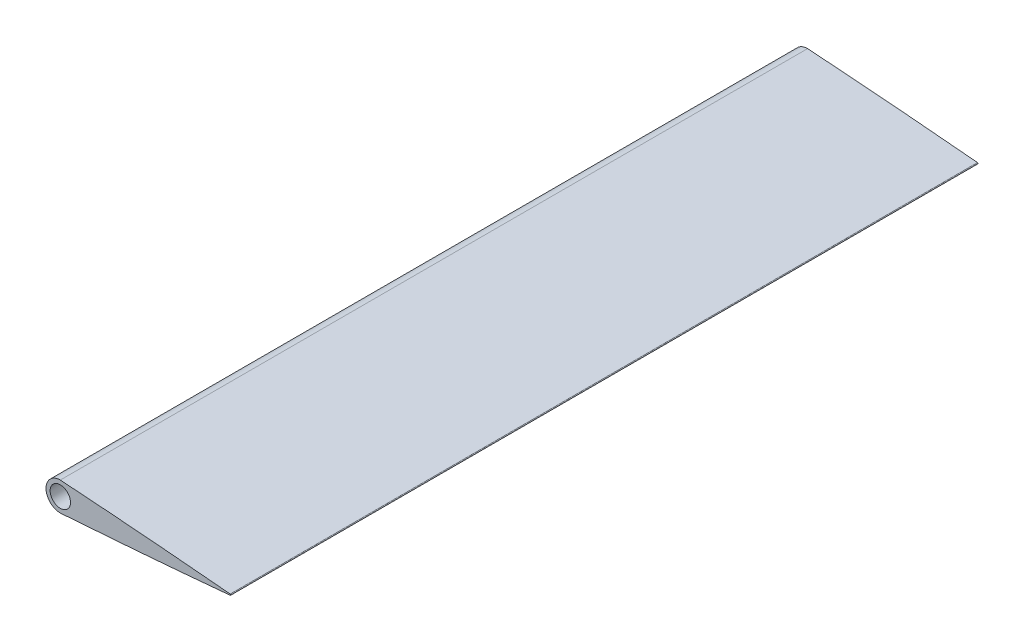
from build123d import *

# Parameters (mm, degrees)
ESTRUSIONE_ESTRUSIONE1_DEPTH = 110
SCHIZZO3_R                   = 1.5
TAGLIO_ESTRUSIONE1_DEPTH     = 149.732133239


with BuildPart() as part:
    # Schizzo2 → Estrusione-Estrusione1 (new body)
    with BuildSketch(Plane.XY):
        with BuildLine():
            ThreePointArc((75, 2.107216055), (72.892783945, 0), (75, -2.107216055))
            add(Edge.make_bspline(
                [(75, -2.107216055), (76.666929758, -1.991522695), (81.668631409, -1.633155952), (88.335559621, -1.11089898), (95.001194725, -0.542172689), (98.333488815, -0.23674648), (100, -0.084)],
                knots=[0.875718334, 0.875718334, 0.875718334, 0.875718334, 0.900556598, 0.950258285, 0.975123707, 1, 1, 1, 1], degree=3))
            ThreePointArc((100, -0.084), (100.084, 0), (100, 0.084))
            add(Edge.make_bspline(
                [(100, 0.084), (98.333488815, 0.23674648), (95.001194725, 0.542172689), (88.335559621, 1.11089898), (81.668631409, 1.633155952), (76.666929758, 1.991522695), (75, 2.107216055)],
                knots=[0, 0, 0, 0, 0.024876293, 0.049741715, 0.099443402, 0.124281666, 0.124281666, 0.124281666, 0.124281666], degree=3))
        make_face()
    extrude(amount=ESTRUSIONE_ESTRUSIONE1_DEPTH)

    # Schizzo3 → Taglio-Estrusione1 (cut, through all)
    with BuildSketch(Plane.XY.offset(110)):
        with Locations((75, 0)):
            Circle(SCHIZZO3_R)
    extrude(amount=-TAGLIO_ESTRUSIONE1_DEPTH, mode=Mode.SUBTRACT)


solid = part.part
